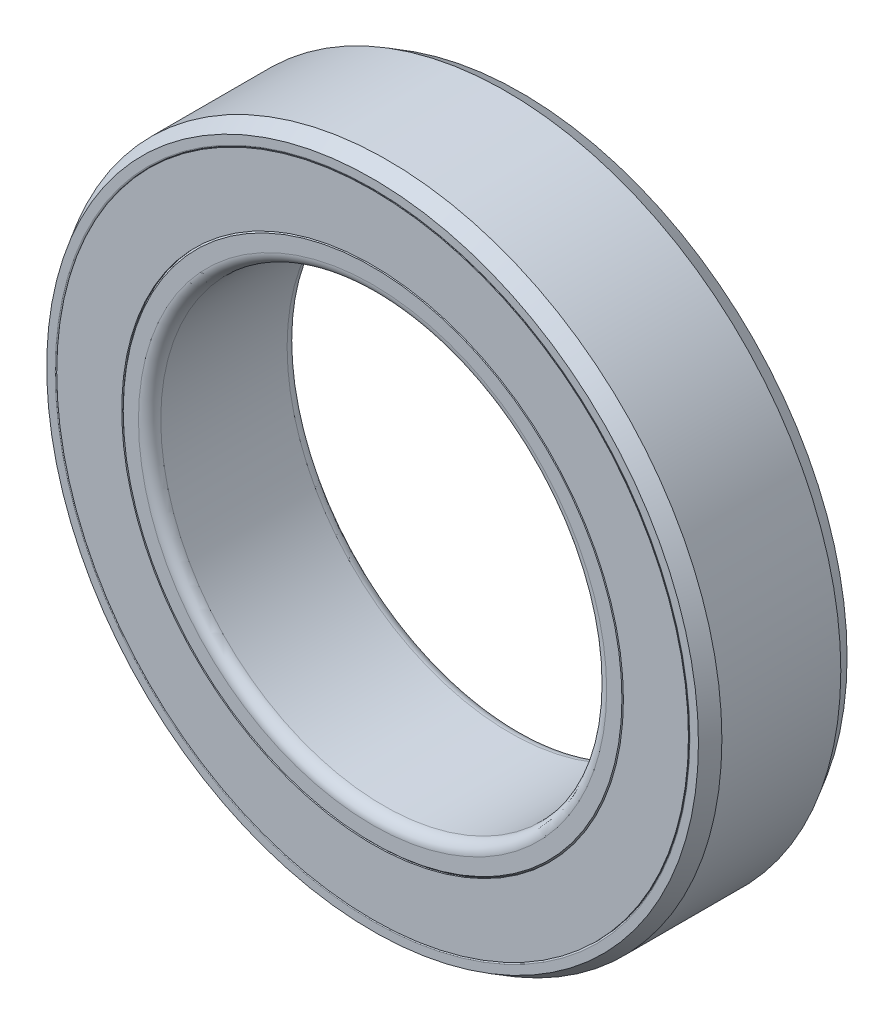
from build123d import *

# Parameters (mm, degrees)
SKETCH4_W         = 0.59375
SKETCH4_H         = 1.75
CIRPATTERN1_COUNT = 7


with BuildPart() as part:
    # Sketch3 → Revolve1 (revolve)
    with BuildSketch(Plane(origin=(0, 0, 0), x_dir=(0, 0, -1), z_dir=(1, 0, 0)), mode=Mode.PRIVATE) as revolve1_sk:
        with BuildLine():
            Line((-1.6, -9), (1.6, -9))
            Line((1.6, -9), (2, -8.769059892))
            Line((2, -8.769059892), (2, -8.54))
            ThreePointArc((2, -8.54), (1.988284271, -8.511715729), (1.96, -8.5))
            Line((1.96, -8.5), (0.833333333, -8.5))
            ThreePointArc((0.833333333, -8.5), (0, -8.833333333), (-0.833333333, -8.5))
            Line((-0.833333333, -8.5), (-1.96, -8.5))
            ThreePointArc((-1.96, -8.5), (-1.988284271, -8.511715729), (-2, -8.54))
            Line((-2, -8.54), (-2, -8.769059892))
            Line((-2, -8.769059892), (-1.6, -9))
        make_face()
        with BuildLine():
            Line((-1.7, -6), (1.7, -6))
            ThreePointArc((1.7, -6), (1.912132034, -6.087867966), (2, -6.3))
            Line((2, -6.3), (2, -6.71))
            Line((2, -6.71), (1.96, -6.75))
            Line((1.96, -6.75), (0.833333333, -6.75))
            ThreePointArc((0.833333333, -6.75), (0, -6.416666667), (-0.833333333, -6.75))
            Line((-0.833333333, -6.75), (-1.96, -6.75))
            Line((-1.96, -6.75), (-2, -6.71))
            Line((-2, -6.71), (-2, -6.3))
            ThreePointArc((-2, -6.3), (-1.912132034, -6.087867966), (-1.7, -6))
        make_face()
    revolve(revolve1_sk.sketch.rotate(Axis((0, 0, 2), (0, 0, -1)), 270), axis=Axis((0, 0, 2), (0, 0, -1)))


with BuildPart() as body_2:
    # Sketch4 → Revolve2 (revolve)
    with BuildSketch(Plane(origin=(0, 0, 0), x_dir=(0, 0, -1), z_dir=(1, 0, 0)), mode=Mode.PRIVATE) as revolve2_sk:
        with Locations((-1.703125, -7.625)):
            Rectangle(SKETCH4_W, SKETCH4_H)
    revolve(revolve2_sk.sketch.rotate(Axis((0, 0, 2), (0, 0, -1)), 270), axis=Axis((0, 0, 2), (0, 0, -1)))


with BuildPart() as body_3:
    # Sketch5 → Revolve3 (revolve)
    with BuildSketch(Plane(origin=(0, 0, 0), x_dir=(0, 0, -1), z_dir=(1, 0, 0))):
        with BuildLine():
            Line((0, -6.416666667), (0, -8.833333333))
            ThreePointArc((0, -8.833333333), (-1.208333333, -7.625), (0, -6.416666667))
        make_face()
    revolve(axis=Axis((0, 0, 0), (0, -1, 0)))


with BuildPart() as cirpattern1_1:
    # CirPattern1: pattern copy
    add(body_3.part.rotate(Axis((0, 0, 0), (0, 0, 1)), 1 * 360 / CIRPATTERN1_COUNT))


with BuildPart() as cirpattern1_2:
    # CirPattern1: pattern copy
    add(body_3.part.rotate(Axis((0, 0, 0), (0, 0, 1)), 2 * 360 / CIRPATTERN1_COUNT))


with BuildPart() as cirpattern1_3:
    # CirPattern1: pattern copy
    add(body_3.part.rotate(Axis((0, 0, 0), (0, 0, 1)), 3 * 360 / CIRPATTERN1_COUNT))


with BuildPart() as cirpattern1_4:
    # CirPattern1: pattern copy
    add(body_3.part.rotate(Axis((0, 0, 0), (0, 0, 1)), 4 * 360 / CIRPATTERN1_COUNT))


with BuildPart() as cirpattern1_5:
    # CirPattern1: pattern copy
    add(body_3.part.rotate(Axis((0, 0, 0), (0, 0, 1)), 5 * 360 / CIRPATTERN1_COUNT))


with BuildPart() as cirpattern1_6:
    # CirPattern1: pattern copy
    add(body_3.part.rotate(Axis((0, 0, 0), (0, 0, 1)), 6 * 360 / CIRPATTERN1_COUNT))


solid = Compound([part.part, body_2.part, body_3.part, cirpattern1_1.part, cirpattern1_2.part, cirpattern1_3.part, cirpattern1_4.part, cirpattern1_5.part, cirpattern1_6.part])
